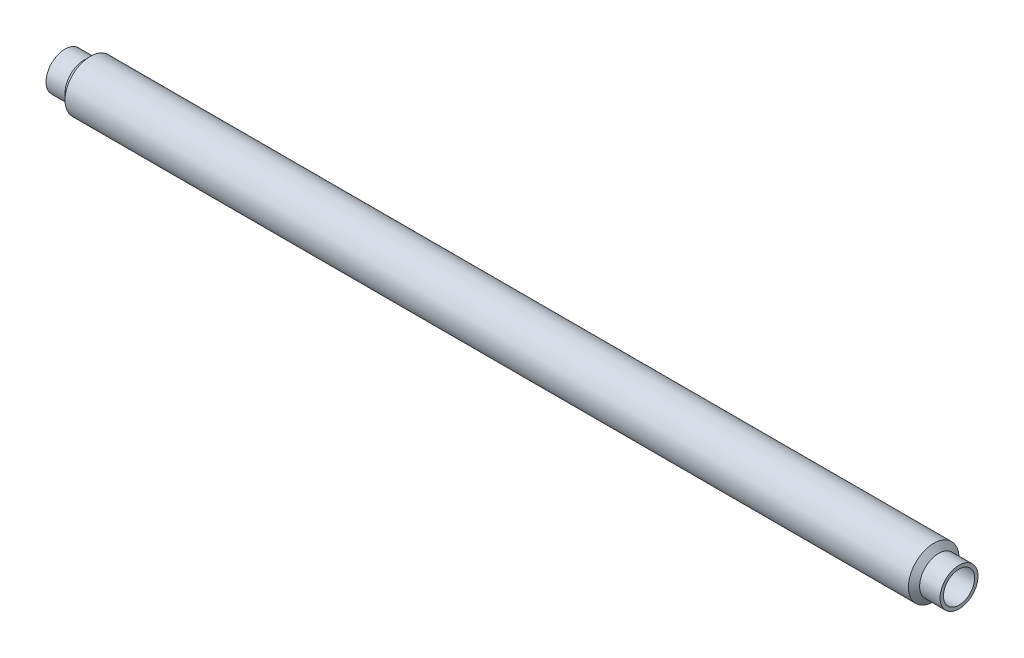
from build123d import *

# Parameters (mm, degrees)
SKETCH1_R           = 150
SKETCH1_R_2         = 62.5
BOSS_EXTRUDE1_DEPTH = 5000
SKETCH2_R           = 112.5
SKETCH2_R_2         = 92.5
BOSS_EXTRUDE2_DEPTH = 150
SKETCH6_R           = 112.5
SKETCH6_R_2         = 87.5
BOSS_EXTRUDE3_DEPTH = 150


with BuildPart() as part:
    # Sketch1 → Boss-Extrude1 (new body)
    with BuildSketch(Plane(origin=(0, 0, 0), x_dir=(0, 0, -1), z_dir=(1, 0, 0))):
        Circle(SKETCH1_R)
        Circle(SKETCH1_R_2, mode=Mode.SUBTRACT)
    extrude(amount=BOSS_EXTRUDE1_DEPTH)



with BuildPart() as body_2:
    # Sketch2 → Boss-Extrude2 (new body)
    with BuildSketch(Plane(origin=(5000, 0, 0), x_dir=(0, 0, -1), z_dir=(1, 0, 0))):
        Circle(SKETCH2_R)
        Circle(SKETCH2_R_2, mode=Mode.SUBTRACT)
    extrude(amount=BOSS_EXTRUDE2_DEPTH)


with BuildPart() as part_1:
    add(part.part)

    add(body_2.part)  # Revolve1 merges body 2
    # Sketch4 → Revolve1 (revolve)
    with BuildSketch(Plane.XY, mode=Mode.PRIVATE) as revolve1_sk:
        Polygon((5000, 150), (5000, 112.5), (5028.950183413, 112.5), align=None)
    revolve(revolve1_sk.sketch.rotate(Axis((5128.632077333, 0, 0), (-1, 0, 0)), 90), axis=Axis((5128.632077333, 0, 0), (-1, 0, 0)))



with BuildPart() as body_2_2:
    # Sketch6 → Boss-Extrude3 (new body)
    with BuildSketch(Plane.ZY):
        with Locations(Location((0, 0, 0), (0, 0, 180))):
            Circle(SKETCH6_R)
        Circle(SKETCH6_R_2, mode=Mode.SUBTRACT)
    extrude(amount=BOSS_EXTRUDE3_DEPTH)


with BuildPart() as part_2:
    add(part_1.part)

    add(body_2_2.part)  # Revolve2 merges body 2 2
    # Sketch7 → Revolve2 (revolve)
    with BuildSketch(Plane.XY, mode=Mode.PRIVATE) as revolve2_sk:
        Polygon((0, 150), (0, 112.5), (-37.119562434, 112.5), align=None)
    revolve(revolve2_sk.sketch.rotate(Axis((0, 0, 0), (-1, 0, 0)), 90), axis=Axis((0, 0, 0), (-1, 0, 0)))


solid = part_2.part
